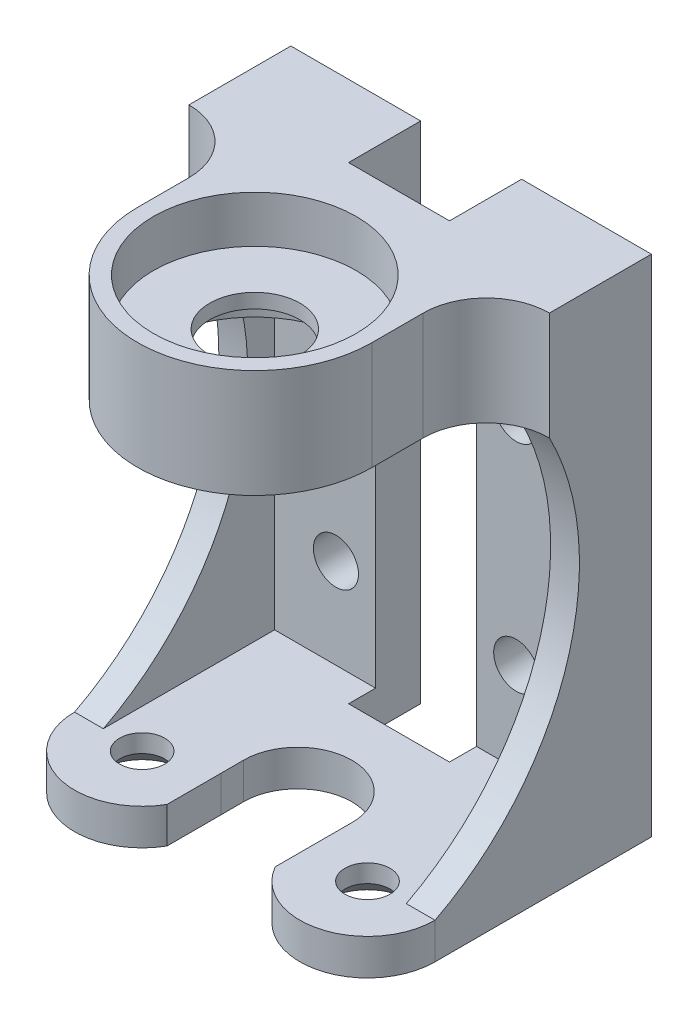
from build123d import *

# Parameters (mm, degrees)
SKETCH1_W           = 25.4
SKETCH1_H           = 35.56
SKETCH1_R           = 1.5875
BOSS_EXTRUDE1_DEPTH = 3.175
SKETCH7_W           = 25.4
SKETCH7_H           = 2.54
SKETCH7_H_2         = 7.62
BOSS_EXTRUDE3_DEPTH = 20.32
SKETCH11_R          = 1.5875
CUT_EXTRUDE1_DEPTH  = 10
CHAMFER2_SIZE       = 1.27
SKETCH13_R          = 3.175
CUT_EXTRUDE2_DEPTH  = 12.7
SKETCH14_R          = 7.14375
CUT_EXTRUDE3_DEPTH  = 3.302
CUT_EXTRUDE4_START  = -3.302
SKETCH15_R          = 7.14375
CUT_EXTRUDE4_DEPTH  = 3.302
CUT_EXTRUDE5_DEPTH  = 12.7
SKETCH17_W          = 2.029010409
SKETCH17_H          = 25.4
BOSS_EXTRUDE4_DEPTH = 12.7
CUT_EXTRUDE6_DEPTH  = 46.281333074
SKETCH19_W          = 7.112
SKETCH19_H          = 5.08
CUT_EXTRUDE7_DEPTH  = 45.472672789


with BuildPart() as part:
    # Sketch1 → Boss-Extrude1 (new body)
    with BuildSketch(Plane.XY):
        with Locations((0, 11.43)):
            Rectangle(SKETCH1_W, SKETCH1_H)
        with Locations((-6.35, 2.54)):
            Circle(SKETCH1_R, mode=Mode.SUBTRACT)
        with Locations(Location((6.35, 2.54, 0), (0, 0, 180))):
            Circle(SKETCH1_R, mode=Mode.SUBTRACT)
        with Locations((6.35, 17.78)):
            Circle(SKETCH1_R, mode=Mode.SUBTRACT)
        with Locations(Location((-6.35, 17.78, 0), (0, 0, 180))):
            Circle(SKETCH1_R, mode=Mode.SUBTRACT)
    extrude(amount=BOSS_EXTRUDE1_DEPTH)

    # Sketch7 → Boss-Extrude3 (add)
    with BuildSketch(Plane.XY.offset(3.175)):
        with Locations((0, -5.08)):
            Rectangle(SKETCH7_W, SKETCH7_H)
        with Locations((0, 25.4)):
            Rectangle(SKETCH7_W, SKETCH7_H_2)
    extrude(amount=BOSS_EXTRUDE3_DEPTH)

    # Sketch11 → Cut-Extrude1 (cut)
    with BuildSketch(Plane.XZ.offset(6.35)):
        with BuildLine():
            Line((-3.81, 13.805952441), (-3.814692285, 12.218981082))
            ThreePointArc((-3.814692285, 12.218981082), (0, 8.404288797), (3.814692285, 12.218981082))
            Line((3.814692285, 12.218981082), (3.81, 13.805952441))
            Line((3.81, 13.805952441), (3.81, 17.615952441))
            ThreePointArc((3.81, 17.615952441), (9.167172212, 19.841012117), (12.7, 15.24))
            Line((12.7, 15.24), (12.7, 23.495))
            Line((12.7, 23.495), (-12.7, 23.495))
            Line((-12.7, 23.495), (-12.7, 15.24))
            ThreePointArc((-12.7, 15.24), (-9.167172212, 19.841012117), (-3.81, 17.615952441))
            Line((-3.81, 17.615952441), (-3.81, 13.805952441))
        make_face()
        with Locations((-7.9375, 15.24)):
            Circle(SKETCH11_R)
        with Locations((7.9375, 15.24)):
            Circle(SKETCH11_R)
    extrude(amount=-CUT_EXTRUDE1_DEPTH, mode=Mode.SUBTRACT)

    # Chamfer2
    chamfer2_edges = [part.edges().sort_by_distance(p)[0] for p in [
        (-9.525, -6.35, 15.24),
        (6.35, -6.35, 15.24),
    ]]
    chamfer(chamfer2_edges, length=CHAMFER2_SIZE)

    # Sketch13 → Cut-Extrude2 (cut)
    with BuildSketch(Plane(origin=(0, 29.21, 0), x_dir=(1, 0, 0), z_dir=(0, 1, 0))):
        with Locations(Location((0, -15.24, 0), (0, 0, 270))):
            Circle(SKETCH13_R)
    extrude(amount=-CUT_EXTRUDE2_DEPTH, mode=Mode.SUBTRACT)

    # Sketch14 → Cut-Extrude3 (cut)
    with BuildSketch(Plane(origin=(0, 29.21, 0), x_dir=(1, 0, 0), z_dir=(0, 1, 0))):
        with Locations(Location((0, -15.24, 0), (0, 0, 270))):
            Circle(SKETCH14_R)
    extrude(amount=-CUT_EXTRUDE3_DEPTH, mode=Mode.SUBTRACT)

    # Sketch15 → Cut-Extrude4 (cut)
    with BuildSketch(Plane.XZ.offset(-21.59).offset(CUT_EXTRUDE4_START)):
        with Locations(Location((0, 15.24, 0), (0, 0, 90))):
            Circle(SKETCH15_R)
    extrude(amount=CUT_EXTRUDE4_DEPTH, mode=Mode.SUBTRACT)

    # Sketch16 → Cut-Extrude5 (cut)
    with BuildSketch(Plane(origin=(0, 29.21, 0), x_dir=(1, 0, 0), z_dir=(0, 1, 0))):
        with BuildLine():
            ThreePointArc((8.255, -15.24), (5.837166479, -21.077166479), (0, -23.495))
            Line((0, -23.495), (12.7, -23.495))
            Line((12.7, -23.495), (12.7, -7.184415797))
            ThreePointArc((12.7, -7.184415797), (9.556910358, -8.486326154), (8.255, -11.629415797))
            Line((8.255, -11.629415797), (8.255, -15.24))
        make_face()
        with BuildLine():
            ThreePointArc((0, -23.495), (-5.837166479, -21.077166479), (-8.255, -15.24))
            Line((-8.255, -15.24), (-8.255, -11.629415797))
            ThreePointArc((-8.255, -11.629415797), (-9.556910358, -8.486326154), (-12.7, -7.184415797))
            Line((-12.7, -7.184415797), (-12.7, -23.495))
            Line((-12.7, -23.495), (0, -23.495))
        make_face()
    extrude(amount=-CUT_EXTRUDE5_DEPTH, mode=Mode.SUBTRACT)

    # Sketch17 → Boss-Extrude4 (add)
    with BuildSketch(Plane.XY.offset(3.175)):
        with Locations((-11.685494796, 8.89)):
            Rectangle(SKETCH17_W, SKETCH17_H)
        with Locations((11.685494796, 8.89)):
            Rectangle(SKETCH17_W, SKETCH17_H)
    extrude(amount=BOSS_EXTRUDE4_DEPTH)

    # Sketch18 → Cut-Extrude6 (cut, through all)
    with BuildSketch(Plane(origin=(12.7, 0, 0), x_dir=(0, 0, -1), z_dir=(1, 0, 0))):
        with BuildLine():
            ThreePointArc((-7.184415797, 21.59), (-5.951695656, 7.221633885), (-15.24, -3.81))
            Line((-15.24, -3.81), (-15.875, -3.81))
            Line((-15.875, -3.81), (-15.875, 21.59))
            Line((-15.875, 21.59), (-7.184415797, 21.59))
        make_face()
    extrude(amount=-CUT_EXTRUDE6_DEPTH, mode=Mode.SUBTRACT)

    # Sketch19 → Cut-Extrude7 (cut, through all)
    with BuildSketch(Plane(origin=(0, 29.21, 0), x_dir=(1, 0, 0), z_dir=(0, 1, 0))):
        with Locations((0, -2.54)):
            Rectangle(SKETCH19_W, SKETCH19_H)
    extrude(amount=-CUT_EXTRUDE7_DEPTH, mode=Mode.SUBTRACT)


solid = part.part
